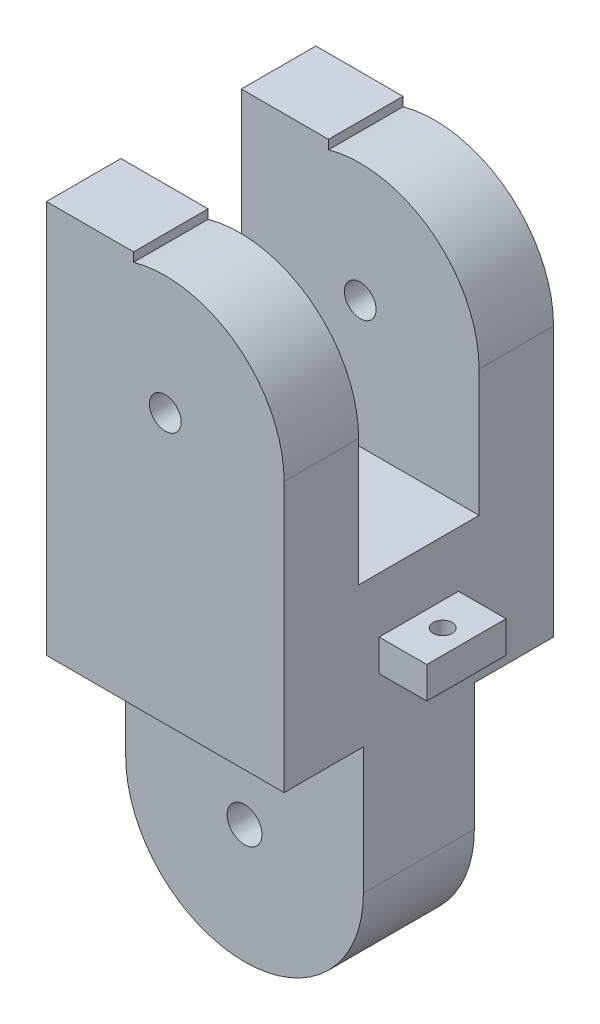
from build123d import *

# Parameters (mm, degrees)
LINK1_BODY_DEPTH       = 8.5
TONGUE_CUT_DEPTH       = 37.789944278
TONGUE_CUT_DEPTH_BACK  = 37.789944278
SKETCH1_W              = 5.5
SKETCH1_H              = 15.998130079
SKETCH7_W              = 5.5
SKETCH7_H              = 7.8
BOSS_EXTRUDE1_DEPTH    = 8.5
SLOT_CUT_DEPTH         = 35.703602119
SLOT_CUT_DEPTH_BACK    = 35.703602119
SKETCH2_W              = 7.6
SKETCH2_H              = 18
PIN_HOLES_DEPTH        = 35.703602119
PIN_HOLES_DEPTH_BACK   = 35.703602119
SKETCH3_R              = 1.1
SKETCH3_R_2            = 1
SKETCH4_W              = 3.5
SKETCH4_H              = 2
GUIDE_BLOCK_1_DEPTH    = 2.5
CORD_GUIDES_DEPTH      = 36.473088391
CORD_GUIDES_DEPTH_BACK = 36.473088391
SKETCH6_R              = 0.6


with BuildPart() as part:
    # Link1_Outline → Link1_Body (new, symmetric)
    with BuildSketch(Plane.XY):
        with BuildLine():
            Line((-7.5, 0), (-7.5, 25))
            ThreePointArc((-7.5, 25), (0, 32.5), (7.5, 25))
            Line((7.5, 25), (7.5, 0))
            ThreePointArc((7.5, 0), (0, -7.5), (-7.5, 0))
        make_face()
    extrude(amount=LINK1_BODY_DEPTH, both=True)

    # Sketch1 → Tongue_Cut (cut, two sides: drawn at the far end of the back side and taken through both)
    with BuildSketch(Plane(origin=(7.5, 0, 0), x_dir=(0, 0, -1), z_dir=(1, 0, 0)).offset(-TONGUE_CUT_DEPTH_BACK)):
        with Locations((6.25, -0.00093496)):
            Rectangle(SKETCH1_W, SKETCH1_H)
        with Locations((-6.25, -0.00093496)):
            Rectangle(SKETCH1_W, SKETCH1_H)
    extrude(amount=TONGUE_CUT_DEPTH + TONGUE_CUT_DEPTH_BACK, mode=Mode.SUBTRACT)

    # Sketch7 → Boss-Extrude1 (add, symmetric)
    with BuildSketch(Plane.XY):
        with Locations((-4.75, 28.9)):
            Rectangle(SKETCH7_W, SKETCH7_H)
    extrude(amount=BOSS_EXTRUDE1_DEPTH, both=True)

    # Sketch2 → Slot_Cut (cut, two sides: drawn at the far end of the back side and taken through both)
    with BuildSketch(Plane(origin=(0, 0, 0), x_dir=(0, 0, -1), z_dir=(1, 0, 0)).offset(-SLOT_CUT_DEPTH_BACK)):
        with Locations((0, 26)):
            Rectangle(SKETCH2_W, SKETCH2_H)
    extrude(amount=SLOT_CUT_DEPTH + SLOT_CUT_DEPTH_BACK, mode=Mode.SUBTRACT)

    # Sketch3 → Pin_Holes (cut, two sides: drawn at the far end of the back side and taken through both)
    with BuildSketch(Plane.XY.offset(-PIN_HOLES_DEPTH_BACK)):
        Circle(SKETCH3_R)
        with Locations((0, 25)):
            Circle(SKETCH3_R_2)
    extrude(amount=PIN_HOLES_DEPTH + PIN_HOLES_DEPTH_BACK, mode=Mode.SUBTRACT)

    # Sketch4 → Guide_Block_1 (add, symmetric)
    with BuildSketch(Plane.XY):
        with Locations((8.75, 12.5)):
            Rectangle(SKETCH4_W, SKETCH4_H)
    extrude(amount=GUIDE_BLOCK_1_DEPTH, both=True)

    # Sketch6 → Cord_Guides (cut, two sides: drawn at the far end of the back side and taken through both)
    with BuildSketch(Plane(origin=(0, 0, 0), x_dir=(1, 0, 0), z_dir=(0, 1, 0)).offset(-CORD_GUIDES_DEPTH_BACK)):
        with Locations(Location((9, 0, 0), (0, 0, 90))):
            Circle(SKETCH6_R)
    extrude(amount=CORD_GUIDES_DEPTH + CORD_GUIDES_DEPTH_BACK, mode=Mode.SUBTRACT)


solid = part.part
